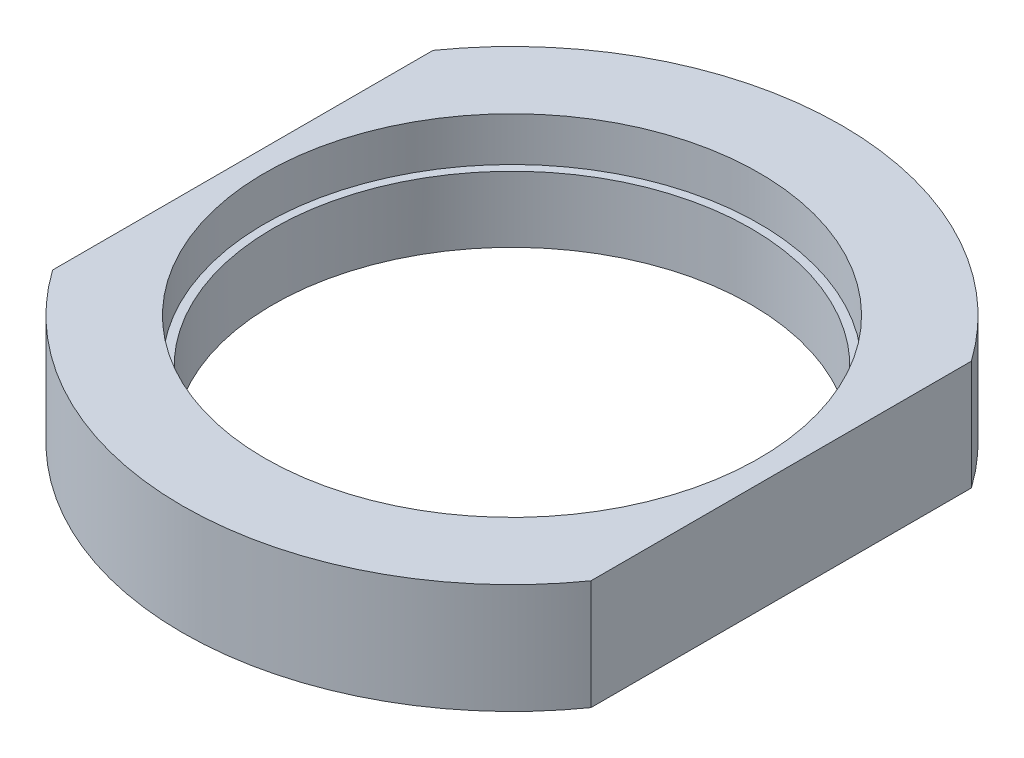
from build123d import *

# Parameters (mm, degrees)
BOSS_EXTRUDE1_DEPTH = 20
SKETCH2_R           = 43.5
CUT_EXTRUDE2_DEPTH  = 81.006249756
SKETCH3_R           = 45
CUT_EXTRUDE3_DEPTH  = 8


with BuildPart() as part:
    # Sketch1 → Boss-Extrude1 (new body)
    with BuildSketch(Plane(origin=(0, 0, 0), x_dir=(1, 0, 0), z_dir=(0, 1, 0))):
        with BuildLine():
            Line((-49, -34.626579386), (-49, 34.626579386))
            ThreePointArc((-49, 34.626579386), (0, 60), (49, 34.626579386))
            Line((49, 34.626579386), (49, -34.626579386))
            ThreePointArc((49, -34.626579386), (0, -60), (-49, -34.626579386))
        make_face()
    extrude(amount=BOSS_EXTRUDE1_DEPTH)

    # Sketch2 → Cut-Extrude2 (cut, through all)
    with BuildSketch(Plane.XZ):
        with Locations(Location((0, 0, 0), (0, 0, 270))):
            Circle(SKETCH2_R)
    extrude(amount=-CUT_EXTRUDE2_DEPTH, mode=Mode.SUBTRACT)

    # Sketch3 → Cut-Extrude3 (cut)
    with BuildSketch(Plane(origin=(0, 20, 0), x_dir=(1, 0, 0), z_dir=(0, 1, 0))):
        with Locations(Location((0, 0, 0), (0, 0, 270))):
            Circle(SKETCH3_R)
    extrude(amount=-CUT_EXTRUDE3_DEPTH, mode=Mode.SUBTRACT)


solid = part.part
